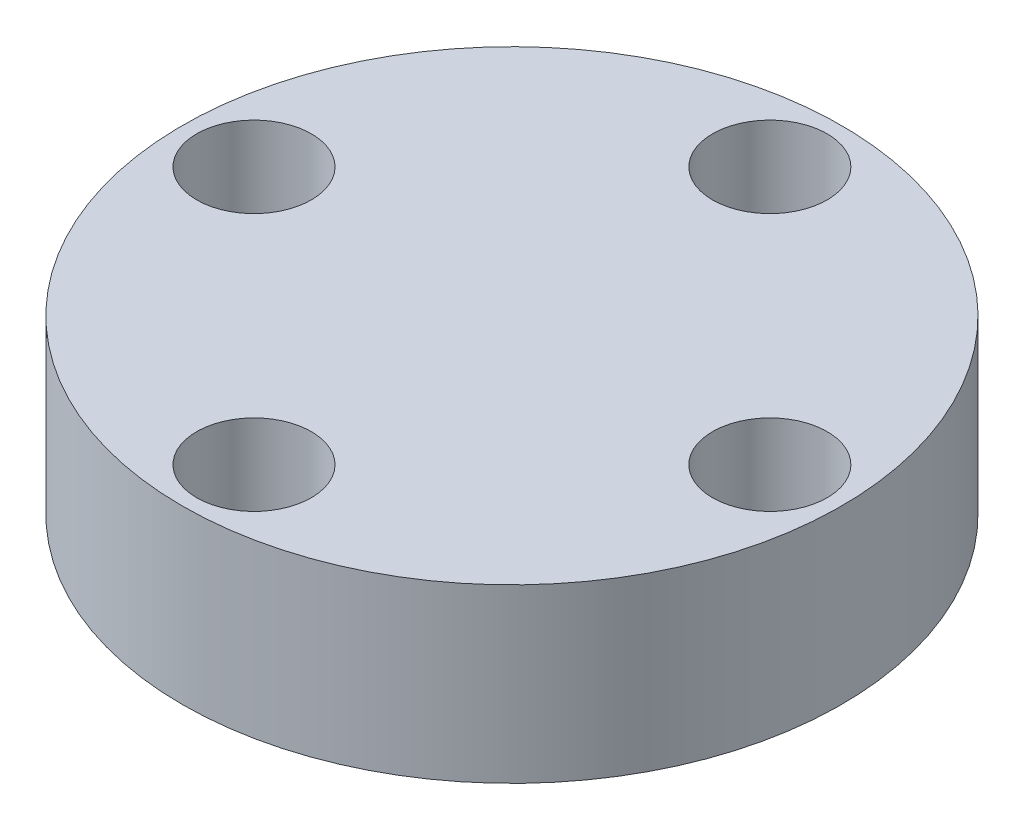
from build123d import *

# Parameters (mm, degrees)
SKETCH_1_R          = 5.75
EXTRUDE_1_DEPTH     = 3
SKETCH_2_R          = 1
CUT_EXTRUDE_2_DEPTH = 3


with BuildPart() as part:
    # 草图1 → 凸台-拉伸1 (new body)
    with BuildSketch(Plane(origin=(0, 0, 0), x_dir=(1, 0, 0), z_dir=(0, 1, 0))):
        with Locations(Location((0, 0, 0), (0, 0, 270))):
            Circle(SKETCH_1_R)
    extrude(amount=EXTRUDE_1_DEPTH)

    # 草图2 → 切除-拉伸2 (cut)
    with BuildSketch(Plane(origin=(0, 3, 0), x_dir=(1, 0, 0), z_dir=(0, 1, 0))):
        with Locations(Location((0, 4.5, 0), (0, 0, 270))):
            Circle(SKETCH_2_R)
        with Locations(Location((4.5, 0, 0), (0, 0, 270))):
            Circle(SKETCH_2_R)
        with Locations(Location((0, -4.5, 0), (0, 0, 270))):
            Circle(SKETCH_2_R)
        with Locations(Location((-4.5, 0, 0), (0, 0, 270))):
            Circle(SKETCH_2_R)
    extrude(amount=-CUT_EXTRUDE_2_DEPTH, mode=Mode.SUBTRACT)


solid = part.part
